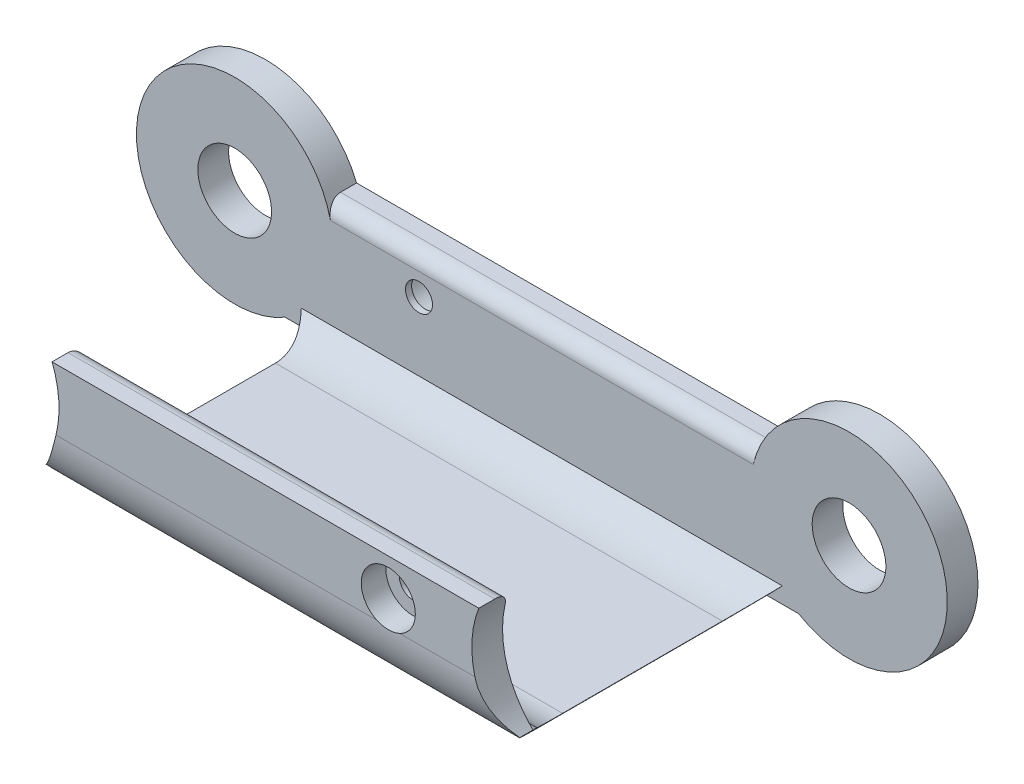
from build123d import *

# Parameters (mm, degrees)
SKETCH_1_W          = 50
SKETCH_1_H          = 25
EXTRUDE_1_DEPTH     = 11
CUT_EXTRUDE_1_DEPTH = 53.699620492
CUT_EXTRUDE_2_DEPTH = 53.699620492
SKETCH_6_R          = 8
EXTRUDE_4_DEPTH     = 2.5
SKETCH_9_R          = 3
SKETCH_9_R_2        = 1.1
CUT_EXTRUDE_4_DEPTH = 2.5
SKETCH_12_R         = 2.2
CUT_EXTRUDE_5_DEPTH = 2
SKETCH_11_R         = 2.2
CUT_EXTRUDE_6_DEPTH = 2
SKETCH_13_R         = 8.2
CUT_EXTRUDE_7_DEPTH = 2.5
SKETCH_14_R         = 3
SKETCH_14_R_2       = 1.1
CUT_EXTRUDE_8_DEPTH = 2.5
CUT_EXTRUDE_9_DEPTH = 25
FILLET_1_R          = 1.2


with BuildPart() as part:
    # 草图1 → 凸台-拉伸1 (new body)
    with BuildSketch(Plane(origin=(0, 0, 0), x_dir=(1, 0, 0), z_dir=(0, 1, 0))):
        Rectangle(SKETCH_1_W, SKETCH_1_H)
    extrude(amount=EXTRUDE_1_DEPTH)

    # 草图2 → 切除-拉伸1 (cut, through all)
    with BuildSketch(Plane(origin=(25, 0, 0), x_dir=(0, 0, -1), z_dir=(1, 0, 0))):
        with BuildLine():
            Line((-12.5, 0), (-6.5, 0))
            ThreePointArc((-6.5, 0), (-10.742640687, 1.757359313), (-12.5, 6))
            Line((-12.5, 6), (-12.5, 0))
        make_face()
        with BuildLine():
            Line((12.5, 6), (12.5, 0))
            Line((12.5, 0), (6.5, 0))
            ThreePointArc((6.5, 0), (10.742640687, 1.757359313), (12.5, 6))
        make_face()
    extrude(amount=-CUT_EXTRUDE_1_DEPTH, mode=Mode.SUBTRACT)

    # 草图3 → 切除-拉伸2 (cut, through all)
    with BuildSketch(Plane(origin=(25, 0, 0), x_dir=(0, 0, -1), z_dir=(1, 0, 0))):
        with BuildLine():
            Line((-10, 11), (10, 11))
            Line((10, 11), (10, 2.429285786))
            ThreePointArc((10, 2.429285786), (8.390294809, 1.371092404), (6.5, 1))
            Line((6.5, 1), (-6.5, 1))
            ThreePointArc((-6.5, 1), (-8.390294809, 1.371092404), (-10, 2.429285786))
            Line((-10, 2.429285786), (-10, 11))
        make_face()
    extrude(amount=-CUT_EXTRUDE_2_DEPTH, mode=Mode.SUBTRACT)

    # 草图6 → 凸台-拉伸4 (add)
    with BuildSketch(Plane(origin=(0, 0, -12.5), x_dir=(-1, 0, 0), z_dir=(0, 0, -1))):
        with Locations((25, 8)):
            Circle(SKETCH_6_R)
        with Locations((-25, 8)):
            Circle(SKETCH_6_R)
    extrude(amount=-EXTRUDE_4_DEPTH)

    # 草图9 → 切除-拉伸4 (cut)
    with BuildSketch(Plane.XY.offset(12.5)):
        with Locations((25, 8)):
            Circle(SKETCH_9_R)
        with Locations((10, 8)):
            Circle(SKETCH_9_R_2)
    extrude(amount=-CUT_EXTRUDE_4_DEPTH, mode=Mode.SUBTRACT)

    # 草图12 → 切除-拉伸5 (cut)
    with BuildSketch(Plane.XY.offset(12.5)):
        with Locations((10, 8)):
            Circle(SKETCH_12_R)
    extrude(amount=-CUT_EXTRUDE_5_DEPTH, mode=Mode.SUBTRACT)

    # 草图11 → 切除-拉伸6 (cut)
    with BuildSketch(Plane(origin=(0, 0, -12.5), x_dir=(-1, 0, 0), z_dir=(0, 0, -1))):
        with Locations((10, 8)):
            Circle(SKETCH_11_R)
    extrude(amount=-CUT_EXTRUDE_6_DEPTH, mode=Mode.SUBTRACT)

    # 草图13 → 切除-拉伸7 (cut)
    with BuildSketch(Plane.XY.offset(12.5)):
        with Locations((-25, 8)):
            Circle(SKETCH_13_R)
        with Locations((25, 8)):
            Circle(SKETCH_13_R)
    extrude(amount=-CUT_EXTRUDE_7_DEPTH, mode=Mode.SUBTRACT)

    # 草图14 → 切除-拉伸8 (cut)
    with BuildSketch(Plane(origin=(0, 0, -12.5), x_dir=(-1, 0, 0), z_dir=(0, 0, -1))):
        with Locations((25, 8)):
            Circle(SKETCH_14_R)
        with Locations((-25, 8)):
            Circle(SKETCH_14_R)
        with Locations((10, 8)):
            Circle(SKETCH_14_R_2)
    extrude(amount=-CUT_EXTRUDE_8_DEPTH, mode=Mode.SUBTRACT)

    # 草图15 → 切除-拉伸9 (cut)
    with BuildSketch(Plane.XY.offset(-10)):
        Polygon((25, 8), (25, 0), (17.002930857, -0.216529728), align=None)
        Polygon((-17.002930857, -0.216529728), (-25, 8), (-25, 0), align=None)
    extrude(amount=CUT_EXTRUDE_9_DEPTH, mode=Mode.SUBTRACT)

    # 圆角1
    fillet_1_edges = [part.edges().sort_by_distance(p)[0] for p in [
        (0, 11, 10),
        (0, 11, -10),
    ]]
    fillet(fillet_1_edges, radius=FILLET_1_R)


solid = part.part
